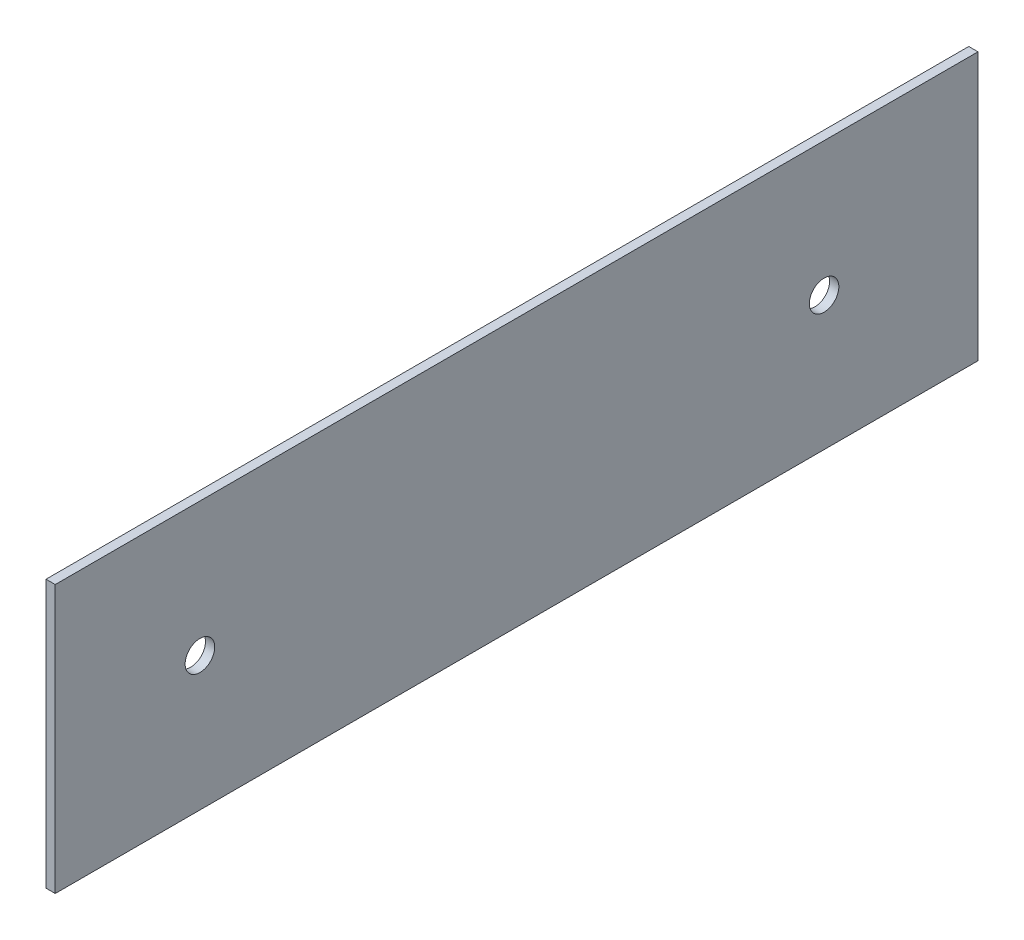
from build123d import *

# Parameters (mm, degrees)
SKETCH2_W           = 500
SKETCH2_H           = 145
BOSS_EXTRUDE1_DEPTH = 5
CUT_EXTRUDE1_REACH  = 266.102
SKETCH3_R           = 8


with BuildPart() as part:
    # Sketch2 → Boss-Extrude1 (new body)
    with BuildSketch(Plane(origin=(0, 0, 0), x_dir=(0, 0, -1), z_dir=(1, 0, 0))):
        with Locations((0, 12.5)):
            Rectangle(SKETCH2_W, SKETCH2_H)
    extrude(amount=BOSS_EXTRUDE1_DEPTH)

    # Sketch3 → Cut-Extrude1 (cut, up to next)
    with BuildSketch(Plane.ZY, mode=Mode.PRIVATE) as cut_extrude1_sk1:
        with Locations((171.600500868, 12.5)):
            Circle(SKETCH3_R)
    cut_extrude1_tool1 = extrude(cut_extrude1_sk1.sketch, amount=-CUT_EXTRUDE1_REACH, mode=Mode.PRIVATE) & part.part
    cut_extrude1 = cut_extrude1_tool1.solids().sort_by_distance((0, 12.5, 171.600501))[0]
    add(cut_extrude1, mode=Mode.SUBTRACT)

    # Mirror1: Cut-Extrude1 across plane
    add(cut_extrude1.mirror(Plane.XY.offset(2.5)), mode=Mode.SUBTRACT)


solid = part.part
